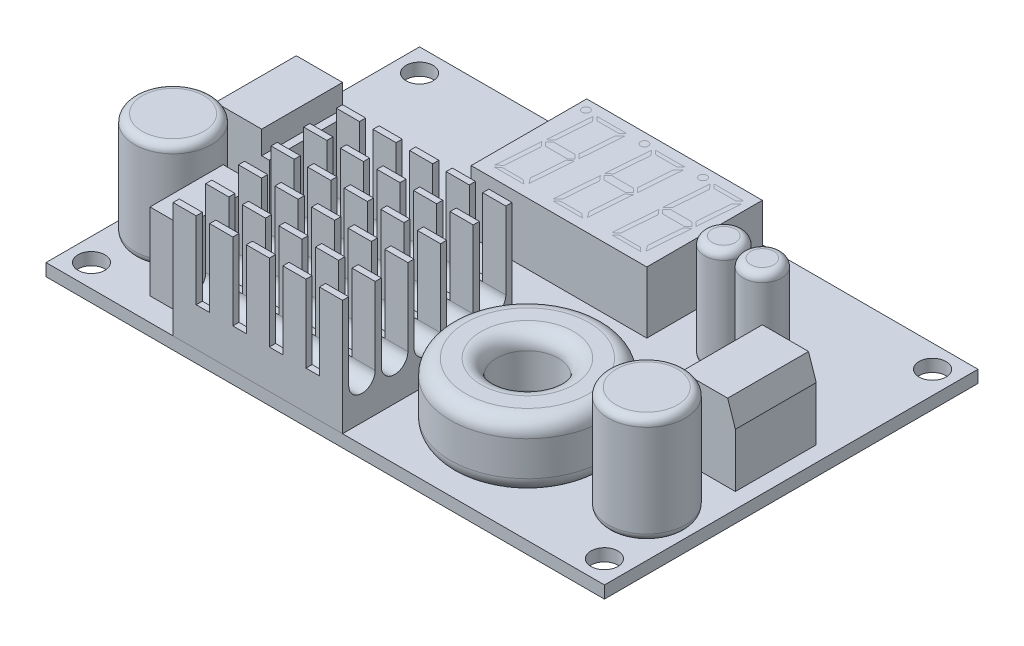
from build123d import *

# Parameters (mm, degrees)
CROQUIS1_W                = 72.5
CROQUIS1_H                = 48.5
CROQUIS1_R                = 1.75
SALIENTE_EXTRUIR1_DEPTH   = 1.6
CROQUIS3_W                = 22.8
CROQUIS3_H                = 15
SALIENTE_EXTRUIR2_DEPTH   = 8
CROQUIS4_R                = 5
SALIENTE_EXTRUIR3_DEPTH   = 14
CROQUIS4_R_2              = 2.5
SALIENTE_EXTRUIR3_2_DEPTH = 14
SALIENTE_EXTRUIR3_3_DEPTH = 14
REDONDEO3_R               = 1
REDONDEO4_R               = 1
REDONDEO5_R               = 1
CROQUIS5_W                = 8
CROQUIS5_H                = 10.5
SALIENTE_EXTRUIR4_DEPTH   = 10
CROQUIS6_W                = 1
CROQUIS6_H                = 3
CORTAR_EXTRUIR1_DEPTH     = 10.5
CROQUIS7_W                = 4.5
CROQUIS7_H                = 9.5
SALIENTE_EXTRUIR5_DEPTH   = 10
CROQUIS8_W                = 22
CROQUIS8_H                = 22
SALIENTE_EXTRUIR6_DEPTH   = 15
CROQUIS9_W                = 3
CROQUIS9_H                = 0.8
CORTAR_EXTRUIR2_DEPTH     = 10
CORTAR_EXTRUIR3_START     = -22
CORTAR_EXTRUIR3_DEPTH     = 22
CROQUIS11_W               = 6
CROQUIS11_H               = 8.5
REDONDEO6_R               = 2


with BuildPart() as part:
    # Croquis1 → Saliente-Extruir1 (new body)
    with BuildSketch(Plane(origin=(0, 0, 0), x_dir=(1, 0, 0), z_dir=(0, 1, 0))):
        Rectangle(CROQUIS1_W, CROQUIS1_H)
        with Locations(Location((-33.3, 21.3, 0), (0, 0, 270))):
            Circle(CROQUIS1_R, mode=Mode.SUBTRACT)
        with Locations(Location((33.3, 21.3, 0), (0, 0, 90))):
            Circle(CROQUIS1_R, mode=Mode.SUBTRACT)
        with Locations(Location((33.3, -21.3, 0), (0, 0, 270))):
            Circle(CROQUIS1_R, mode=Mode.SUBTRACT)
        with Locations(Location((-33.3, -21.3, 0), (0, 0, 90))):
            Circle(CROQUIS1_R, mode=Mode.SUBTRACT)
    extrude(amount=SALIENTE_EXTRUIR1_DEPTH)


with BuildPart() as body_2:
    # Croquis3 → Saliente-Extruir2 (new body)
    with BuildSketch(Plane(origin=(0, 1.6, 0), x_dir=(1, 0, 0), z_dir=(0, 1, 0))):
        with Locations((-0.15, 13.75)):
            Rectangle(CROQUIS3_W, CROQUIS3_H)
    extrude(amount=SALIENTE_EXTRUIR2_DEPTH)


with BuildPart() as body_3:
    # Croquis4 → Saliente-Extruir3 (new body)
    with BuildSketch(Plane(origin=(0, 1.6, 0), x_dir=(1, 0, 0), z_dir=(0, 1, 0))):
        with Locations(Location((30.75, -13.25, 0), (0, 0, 270))):
            Circle(CROQUIS4_R)
    extrude(amount=SALIENTE_EXTRUIR3_DEPTH)

    # Redondeo3
    redondeo3_edges = [body_3.edges().sort_by_distance(p)[0] for p in [
        (30.75, 1.6, 8.25),
        (30.75, 15.6, 8.25),
    ]]
    fillet(redondeo3_edges, radius=REDONDEO3_R)


with BuildPart() as body_4:
    # Croquis4 → Saliente-Extruir3 2 (new body)
    with BuildSketch(Plane(origin=(0, 1.6, 0), x_dir=(1, 0, 0), z_dir=(0, 1, 0))):
        with Locations(Location((18.75, 8.75, 0), (0, 0, 270))):
            Circle(CROQUIS4_R_2)
    extrude(amount=SALIENTE_EXTRUIR3_2_DEPTH)

    # Redondeo5
    redondeo5_edges = [body_4.edges().sort_by_distance(p)[0] for p in [
        (18.75, 1.6, -11.25),
        (18.75, 15.6, -11.25),
    ]]
    fillet(redondeo5_edges, radius=REDONDEO5_R)


with BuildPart() as body_5:
    # Croquis4 → Saliente-Extruir3 3 (new body)
    with BuildSketch(Plane(origin=(0, 1.6, 0), x_dir=(1, 0, 0), z_dir=(0, 1, 0))):
        with Locations(Location((23.75, 8.75, 0), (0, 0, 270))):
            Circle(CROQUIS4_R_2)
    extrude(amount=SALIENTE_EXTRUIR3_3_DEPTH)

    # Redondeo4
    redondeo4_edges = [body_5.edges().sort_by_distance(p)[0] for p in [
        (23.75, 1.6, -11.25),
        (23.75, 15.6, -11.25),
    ]]
    fillet(redondeo4_edges, radius=REDONDEO4_R)


with BuildPart() as body_6:
    # Simetría1: mirrored copy
    add(body_3.part.mirror(Plane(origin=(0, 0, 0), x_dir=(0, 0, 1), z_dir=(1, 0, 0))))


with BuildPart() as body_7:
    # Croquis5 → Saliente-Extruir4 (new body)
    with BuildSketch(Plane(origin=(0, 1.6, 0), x_dir=(1, 0, 0), z_dir=(0, 1, 0))):
        with Locations((30.25, 0)):
            Rectangle(CROQUIS5_W, CROQUIS5_H)
    extrude(amount=SALIENTE_EXTRUIR4_DEPTH)

    # Croquis6 → Cortar-Extruir1 (cut)
    with BuildSketch(Plane(origin=(0, 0, -5.25), x_dir=(-1, 0, 0), z_dir=(0, 0, -1))):
        Polygon((-34.25, 8.6), (-33.25, 11.6), (-34.25, 11.6), align=None)
        with Locations((-26.75, 10.1)):
            Rectangle(CROQUIS6_W, CROQUIS6_H)
    extrude(amount=-CORTAR_EXTRUIR1_DEPTH, mode=Mode.SUBTRACT)


with BuildPart() as body_8:
    # Simetría2: mirrored copy
    add(body_7.part.mirror(Plane(origin=(0, 0, 0), x_dir=(0, 0, 1), z_dir=(1, 0, 0))))


with BuildPart() as body_9:
    # Croquis7 → Saliente-Extruir5 (new body)
    with BuildSketch(Plane(origin=(0, 1.6, 0), x_dir=(1, 0, 0), z_dir=(0, 1, 0))):
        with Locations((-23.5, -16.5)):
            Rectangle(CROQUIS7_W, CROQUIS7_H)
    extrude(amount=SALIENTE_EXTRUIR5_DEPTH)


with BuildPart() as body_10:
    # Croquis8 → Saliente-Extruir6 (new body)
    with BuildSketch(Plane(origin=(0, 1.6, 0), x_dir=(1, 0, 0), z_dir=(0, 1, 0))):
        with Locations((-8.75, -13.25)):
            Rectangle(CROQUIS8_W, CROQUIS8_H)
    extrude(amount=SALIENTE_EXTRUIR6_DEPTH)

    # Croquis9 → Cortar-Extruir2 (cut)
    with BuildSketch(Plane(origin=(0, 16.6, 0), x_dir=(1, 0, 0), z_dir=(0, 1, 0))):
        Polygon((-15, -2.25), (-15, -3.05), (-12, -3.05), (-12, -2.25), (-10.25, -2.25), (-10.25, -3.05), (-7.25, -3.05), (-7.25, -2.25), (-5.5, -2.25), (-5.5, -3.05), (-2.5, -3.05), (-2.5, -2.25), (-0.75, -2.25), (-0.75, -3.05), (2.25, -3.05), (2.25, -6.49), (-0.75, -6.49), (-0.75, -7.29), (2.25, -7.29), (2.25, -10.73), (-0.75, -10.73), (-0.75, -11.53), (2.25, -11.53), (2.25, -14.97), (-0.75, -14.97), (-0.75, -15.77), (2.25, -15.77), (2.25, -19.21), (-0.75, -19.21), (-0.75, -20.01), (2.25, -20.01), (2.25, -23.45), (-0.75, -23.45), (-0.75, -24.25), (-2.5, -24.25), (-2.5, -23.45), (-5.5, -23.45), (-5.5, -24.25), (-7.25, -24.25), (-7.25, -23.45), (-10.25, -23.45), (-10.25, -24.25), (-12, -24.25), (-12, -23.45), (-15, -23.45), (-15, -24.25), (-16.75, -24.25), (-16.75, -23.45), (-19.75, -23.45), (-19.75, -20.01), (-16.75, -20.01), (-16.75, -19.21), (-19.75, -19.21), (-19.75, -15.77), (-16.75, -15.77), (-16.75, -14.97), (-19.75, -14.97), (-19.75, -11.53), (-16.75, -11.53), (-16.75, -10.73), (-19.75, -10.73), (-19.75, -7.29), (-16.75, -7.29), (-16.75, -6.49), (-19.75, -6.49), (-19.75, -3.05), (-16.75, -3.05), (-16.75, -2.25), align=None)
        with Locations((-13.5, -6.89)):
            Rectangle(CROQUIS9_W, CROQUIS9_H, mode=Mode.SUBTRACT)
        with Locations((-8.75, -6.89)):
            Rectangle(CROQUIS9_W, CROQUIS9_H, mode=Mode.SUBTRACT)
        with Locations((-4, -6.89)):
            Rectangle(CROQUIS9_W, CROQUIS9_H, mode=Mode.SUBTRACT)
        with Locations((-13.5, -11.13)):
            Rectangle(CROQUIS9_W, CROQUIS9_H, mode=Mode.SUBTRACT)
        with Locations((-8.75, -11.13)):
            Rectangle(CROQUIS9_W, CROQUIS9_H, mode=Mode.SUBTRACT)
        with Locations((-4, -11.13)):
            Rectangle(CROQUIS9_W, CROQUIS9_H, mode=Mode.SUBTRACT)
        with Locations((-13.5, -15.37)):
            Rectangle(CROQUIS9_W, CROQUIS9_H, mode=Mode.SUBTRACT)
        with Locations((-8.75, -15.37)):
            Rectangle(CROQUIS9_W, CROQUIS9_H, mode=Mode.SUBTRACT)
        with Locations((-4, -15.37)):
            Rectangle(CROQUIS9_W, CROQUIS9_H, mode=Mode.SUBTRACT)
        with Locations((-13.5, -19.61)):
            Rectangle(CROQUIS9_W, CROQUIS9_H, mode=Mode.SUBTRACT)
        with Locations((-8.75, -19.61)):
            Rectangle(CROQUIS9_W, CROQUIS9_H, mode=Mode.SUBTRACT)
        with Locations((-4, -19.61)):
            Rectangle(CROQUIS9_W, CROQUIS9_H, mode=Mode.SUBTRACT)
    extrude(amount=-CORTAR_EXTRUIR2_DEPTH, mode=Mode.SUBTRACT)

    # Croquis10 → Cortar-Extruir3 (cut)
    with BuildSketch(Plane(origin=(2.25, 0, 0), x_dir=(0, 0, -1), z_dir=(1, 0, 0)).offset(CORTAR_EXTRUIR3_START)):
        with BuildLine():
            Line((-23.45, 6.6), (-20.01, 6.6))
            ThreePointArc((-20.01, 6.6), (-21.73, 4.88), (-23.45, 6.6))
        make_face()
        with BuildLine():
            Line((-19.21, 6.6), (-15.77, 6.6))
            ThreePointArc((-15.77, 6.6), (-17.49, 4.88), (-19.21, 6.6))
        make_face()
        with BuildLine():
            Line((-14.97, 6.6), (-11.53, 6.6))
            ThreePointArc((-11.53, 6.6), (-13.25, 4.88), (-14.97, 6.6))
        make_face()
        with BuildLine():
            Line((-10.73, 6.6), (-7.29, 6.6))
            ThreePointArc((-7.29, 6.6), (-9.01, 4.88), (-10.73, 6.6))
        make_face()
        with BuildLine():
            Line((-6.49, 6.6), (-3.05, 6.6))
            ThreePointArc((-3.05, 6.6), (-4.77, 4.88), (-6.49, 6.6))
        make_face()
    extrude(amount=CORTAR_EXTRUIR3_DEPTH, mode=Mode.SUBTRACT)


with BuildPart() as body_11:
    # Croquis11 → Revolución1 (revolve)
    with BuildSketch(Plane(origin=(14.25, 0, 0), x_dir=(0, 0, -1), z_dir=(1, 0, 0)), mode=Mode.PRIVATE) as revoluci_n1_sk:
        with Locations((-19.25, 5.85)):
            Rectangle(CROQUIS11_W, CROQUIS11_H)
    revolve(revoluci_n1_sk.sketch.rotate(Axis((14.25, 1.6, 12.25), (0, 1, 0)), 180), axis=Axis((14.25, 1.6, 12.25), (0, 1, 0)))

    # Redondeo6
    redondeo6_edges = [body_11.edges().sort_by_distance(p)[0] for p in [
        (14.25, 1.6, 22.25),
        (14.25, 1.6, 16.25),
        (14.25, 10.1, 16.25),
        (14.25, 10.1, 22.25),
    ]]
    fillet(redondeo6_edges, radius=REDONDEO6_R)


solid = Compound([part.part, body_2.part, body_3.part, body_4.part, body_5.part, body_6.part, body_7.part, body_8.part, body_9.part, body_10.part, body_11.part])
